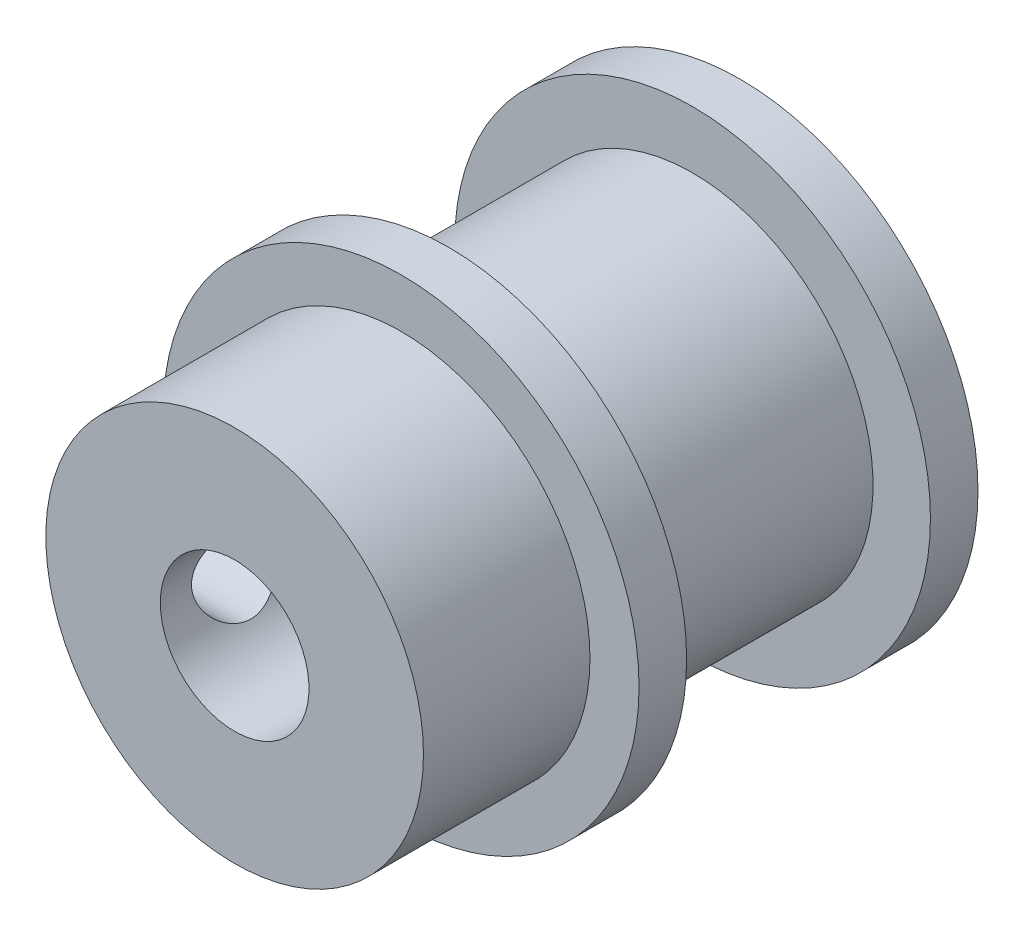
from build123d import *

# Parameters (mm, degrees)
SKETCH1_W                     = 8
SKETCH1_H                     = 1.6
SKETCH2_R                     = 6.07
BOSS_EXTRUDE1_DEPTH           = 8.2
BOSS_EXTRUDE2_START           = -1.6
SKETCH3_R                     = 8
BOSS_EXTRUDE2_DEPTH           = 1.6
SKETCH4_R                     = 6.35
BOSS_EXTRUDE3_DEPTH           = 5.6
F_5_0_5_DIAMETER_HOLE1_D      = 5
F_3_0_3_DIAMETER_HOLE1_REACH  = 23.882
F_3_0_3_DIAMETER_HOLE1_BORE_R = 1.5


with BuildPart() as part:
    # Sketch1 → Revolve1 (revolve)
    with BuildSketch(Plane(origin=(0, 0, 0), x_dir=(1, 0, 0), z_dir=(0, 1, 0))):
        with Locations((4, -10.6)):
            Rectangle(SKETCH1_W, SKETCH1_H)
    revolve(axis=Axis((0, 0, 9.8), (0, 0, 1)))

    # Sketch2 → Boss-Extrude1 (add)
    with BuildSketch(Plane(origin=(0, 0, 9.8), x_dir=(-1, 0, 0), z_dir=(0, 0, -1))):
        Circle(SKETCH2_R)
    extrude(amount=BOSS_EXTRUDE1_DEPTH)

    # Sketch3 → Boss-Extrude2 (add)
    with BuildSketch(Plane.XY.offset(1.6).offset(BOSS_EXTRUDE2_START)):
        Circle(SKETCH3_R)
    extrude(amount=BOSS_EXTRUDE2_DEPTH)

    # Sketch4 → Boss-Extrude3 (add)
    with BuildSketch(Plane.XY.offset(11.4)):
        Circle(SKETCH4_R)
    extrude(amount=BOSS_EXTRUDE3_DEPTH)

    # Ø5.0 (5) Diameter Hole1 (through all)
    with Locations(Plane(origin=(0, 0, 0), x_dir=(-1, 0, 0), z_dir=(0, 0, -1))):
        with Locations((0, 0)):
            Hole(F_5_0_5_DIAMETER_HOLE1_D / 2)

    # Ø3.0 (3) Diameter Hole1 bore (on position points) → Ø3.0 (3) Diameter Hole1 (cut, up to next)
    with BuildSketch(Plane(origin=(-6.35, 0, 14.452836514), x_dir=(0, 0, -1), z_dir=(-1, 0, 0)), mode=Mode.PRIVATE) as f_3_0_3_diameter_hole1_sk1:
        Circle(F_3_0_3_DIAMETER_HOLE1_BORE_R)
    f_3_0_3_diameter_hole1_tool1 = extrude(f_3_0_3_diameter_hole1_sk1.sketch, amount=-F_3_0_3_DIAMETER_HOLE1_REACH, mode=Mode.PRIVATE) & part.part
    add(f_3_0_3_diameter_hole1_tool1.solids().sort_by_distance((-6.35, 0, 14.452837))[0], mode=Mode.SUBTRACT)


solid = part.part
